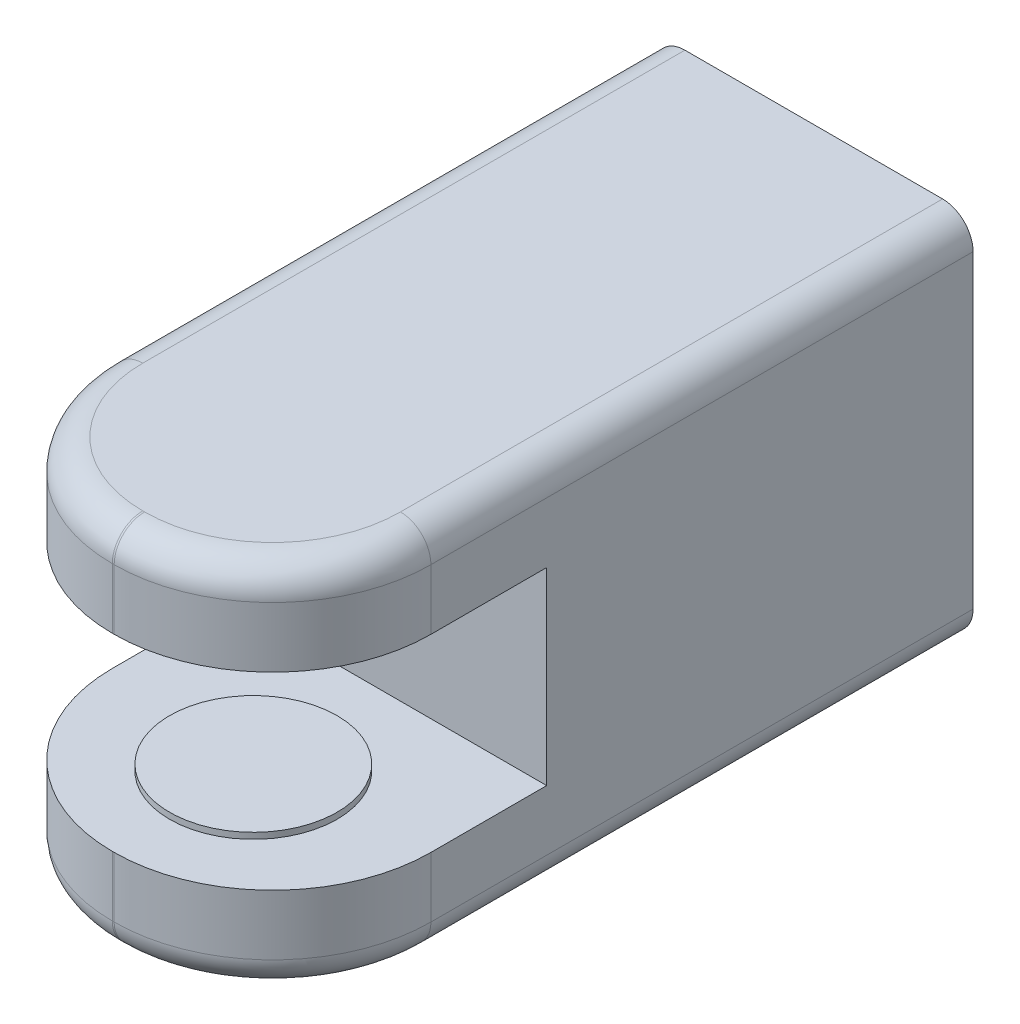
from build123d import *

# Parameters (mm, degrees)
SCHIZZO4_R           = 38.5
CORPOCONTATTO_DEPTH  = 3
CORPOROTANTE_DEPTH   = 60.805
RACCORDO_R           = 10
SCHIZZO6_W           = 104.61
SCHIZZO6_H           = 90
TAGLIOCENTRALE_DEPTH = 31
SCHIZZO7_R           = 27.5
CONTATTO_DEPTH       = 2


with BuildPart() as part:
    # Schizzo4 → CorpoContatto (new body)
    with BuildSketch(Plane.XY):
        Circle(SCHIZZO4_R)
    extrude(amount=CORPOCONTATTO_DEPTH)

    # Schizzo5 → CorpoRotante (add, symmetric)
    with BuildSketch(Plane(origin=(0, 0, 0), x_dir=(1, 0, 0), z_dir=(0, 1, 0))):
        with BuildLine():
            Line((52.305, -3), (-52.305, -3))
            Line((-52.305, -3), (-52.305, -181))
            ThreePointArc((-52.305, -181), (-37.074552622, -217.769552622), (-0.305, -233))
            Line((-0.305, -233), (0.305, -233))
            ThreePointArc((0.305, -233), (37.074552622, -217.769552622), (52.305, -181))
            Line((52.305, -181), (52.305, -3))
        make_face()
    extrude(amount=CORPOROTANTE_DEPTH, both=True)

    # Raccordo
    raccordo_edges = [part.edges().sort_by_distance(p)[0] for p in [
        (52.305, -60.805, 92),
        (-52.305, -60.805, 92),
        (-37.074552622, -60.805, 217.769552622),
        (0, -60.805, 233),
        (37.074552622, -60.805, 217.769552622),
        (52.305, 60.805, 92),
        (-52.305, 60.805, 92),
        (-37.074552622, 60.805, 217.769552622),
        (0, 60.805, 233),
        (37.074552622, 60.805, 217.769552622),
    ]]
    fillet(raccordo_edges, radius=RACCORDO_R)

    # Schizzo6 → TaglioCentrale (cut, symmetric)
    with BuildSketch(Plane(origin=(0, 0, 0), x_dir=(1, 0, 0), z_dir=(0, 1, 0))):
        with Locations((0, -188)):
            Rectangle(SCHIZZO6_W, SCHIZZO6_H)
    extrude(amount=TAGLIOCENTRALE_DEPTH, both=True, mode=Mode.SUBTRACT)

    # Schizzo7 → Contatto (add)
    with BuildSketch(Plane.XZ.offset(-31)):
        with Locations(Location((0, 187, 0), (0, 0, 90))):
            Circle(SCHIZZO7_R)
    contatto = extrude(amount=CONTATTO_DEPTH)

    # Specchia1: Contatto across plane
    add(contatto.mirror(Plane.ZX))


solid = part.part
